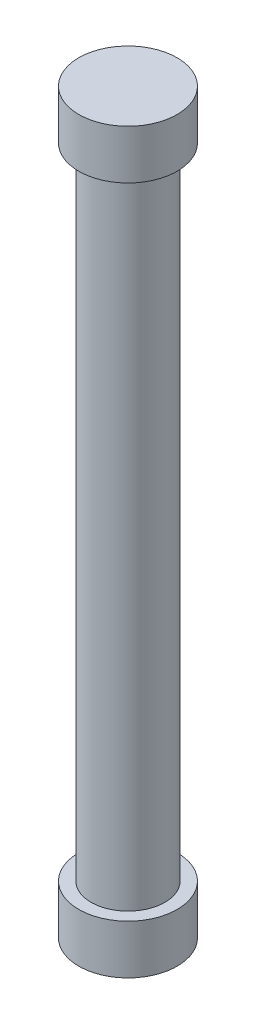
from build123d import *


with BuildPart() as part:
    # Sketch1 → Revolve1 (revolve)
    with BuildSketch(Plane.XY):
        Polygon((0, -30), (-2, -30), (-2, -28), (-1.5, -28), (-1.5, -2), (-2, -2), (-2, 0), (0, 0), align=None)
    revolve(axis=Axis((0, 0, 0), (0, -1, 0)))


solid = part.part
